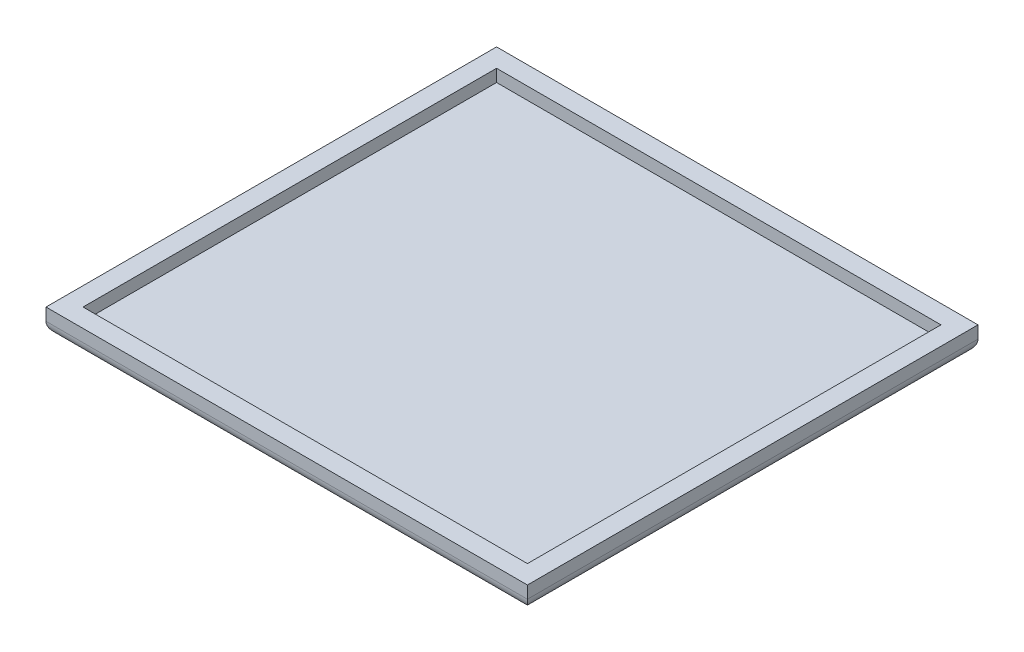
from build123d import *

# Parameters (mm, degrees)
SKETCH2_W           = 78
SKETCH2_H           = 73
BOSS_EXTRUDE1_DEPTH = 4
SKETCH3_W           = 72
SKETCH3_H           = 67
CUT_EXTRUDE1_DEPTH  = 2
FILLET1_R           = 2


with BuildPart() as part:
    # Sketch2 → Boss-Extrude1 (new body)
    with BuildSketch(Plane(origin=(0, 0, 0), x_dir=(1, 0, 0), z_dir=(0, 1, 0))):
        with Locations((39, 36.5)):
            Rectangle(SKETCH2_W, SKETCH2_H)
    extrude(amount=BOSS_EXTRUDE1_DEPTH)

    # Sketch3 → Cut-Extrude1 (cut)
    with BuildSketch(Plane(origin=(0, 4, 0), x_dir=(1, 0, 0), z_dir=(0, 1, 0))):
        with Locations((39, 36.5)):
            Rectangle(SKETCH3_W, SKETCH3_H)
    extrude(amount=-CUT_EXTRUDE1_DEPTH, mode=Mode.SUBTRACT)

    # Fillet1
    fillet1_edges = [part.edges().sort_by_distance(p)[0] for p in [
        (39, 0, -73),
        (78, 0, -36.5),
        (39, 0, 0),
        (0, 0, -36.5),
    ]]
    fillet(fillet1_edges, radius=FILLET1_R)


solid = part.part
